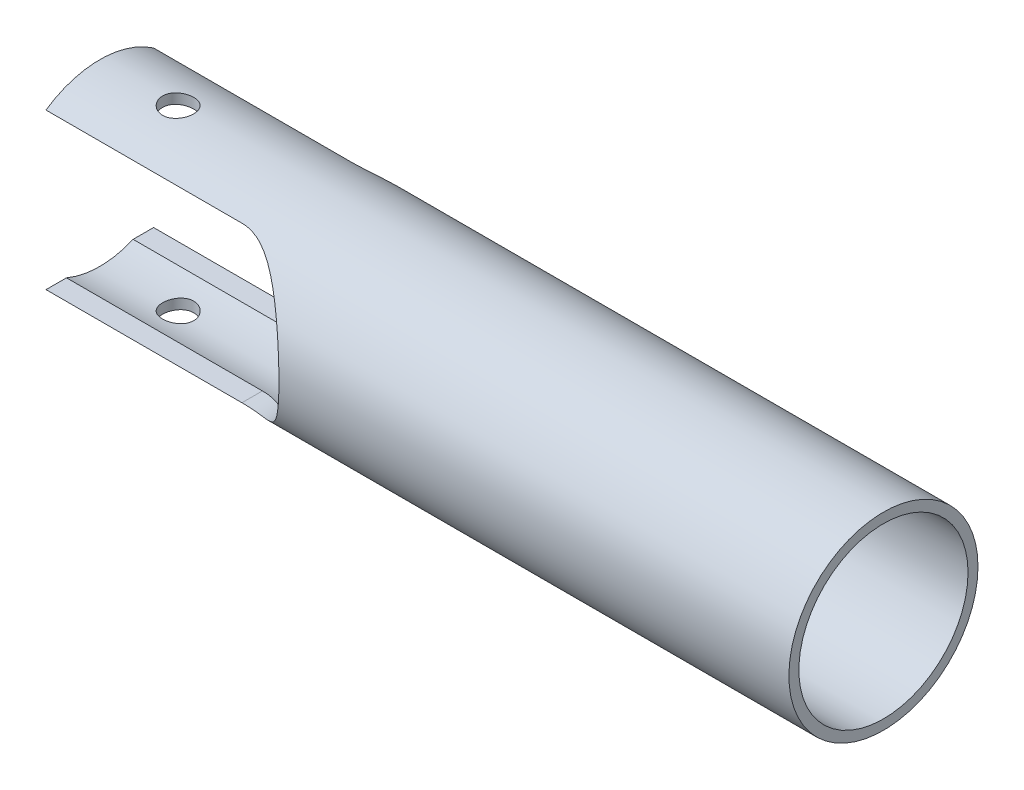
from build123d import *

# Parameters (mm, degrees)
SKETCH1_R               = 1.2065
SKETCH1_R_2             = 1.0795
BOSS_EXTRUDE1_DEPTH     = 10
CUT_EXTRUDE1_DEPTH      = 10
CUT_EXTRUDE1_DEPTH_BACK = 1.5
CUT_EXTRUDE2_DEPTH      = 5
CUT_EXTRUDE2_DEPTH_BACK = 5
SKETCH4_R               = 0.1984375


with BuildPart() as part:
    # Sketch1 → Boss-Extrude1 (new body)
    with BuildSketch(Plane(origin=(0, 0, 0), x_dir=(0, 0, -1), z_dir=(1, 0, 0))):
        Circle(SKETCH1_R)
        Circle(SKETCH1_R_2, mode=Mode.SUBTRACT)
    extrude(amount=BOSS_EXTRUDE1_DEPTH)

    # Sketch2 → Cut-Extrude1 (cut, two sides: drawn at the far end of the back side and taken through both)
    with BuildSketch(Plane.XY.offset(-CUT_EXTRUDE1_DEPTH_BACK)):
        with BuildLine():
            Line((2.5, -0.9921875), (0, -0.9921875))
            Line((0, -0.9921875), (0, 0.9921875))
            Line((0, 0.9921875), (2.5, 0.9921875))
            ThreePointArc((2.5, 0.9921875), (3.4921875, 0), (2.5, -0.9921875))
        make_face()
    extrude(amount=CUT_EXTRUDE1_DEPTH + CUT_EXTRUDE1_DEPTH_BACK, mode=Mode.SUBTRACT)

    # Sketch4 → Cut-Extrude2 (cut, two sides: drawn at the far end of the back side and taken through both)
    with BuildSketch(Plane(origin=(0, 0, 0), x_dir=(1, 0, 0), z_dir=(0, 1, 0)).offset(-CUT_EXTRUDE2_DEPTH_BACK)):
        with Locations(Location((1, 0, 0), (0, 0, 90))):
            Circle(SKETCH4_R)
    extrude(amount=CUT_EXTRUDE2_DEPTH + CUT_EXTRUDE2_DEPTH_BACK, mode=Mode.SUBTRACT)


solid = part.part
